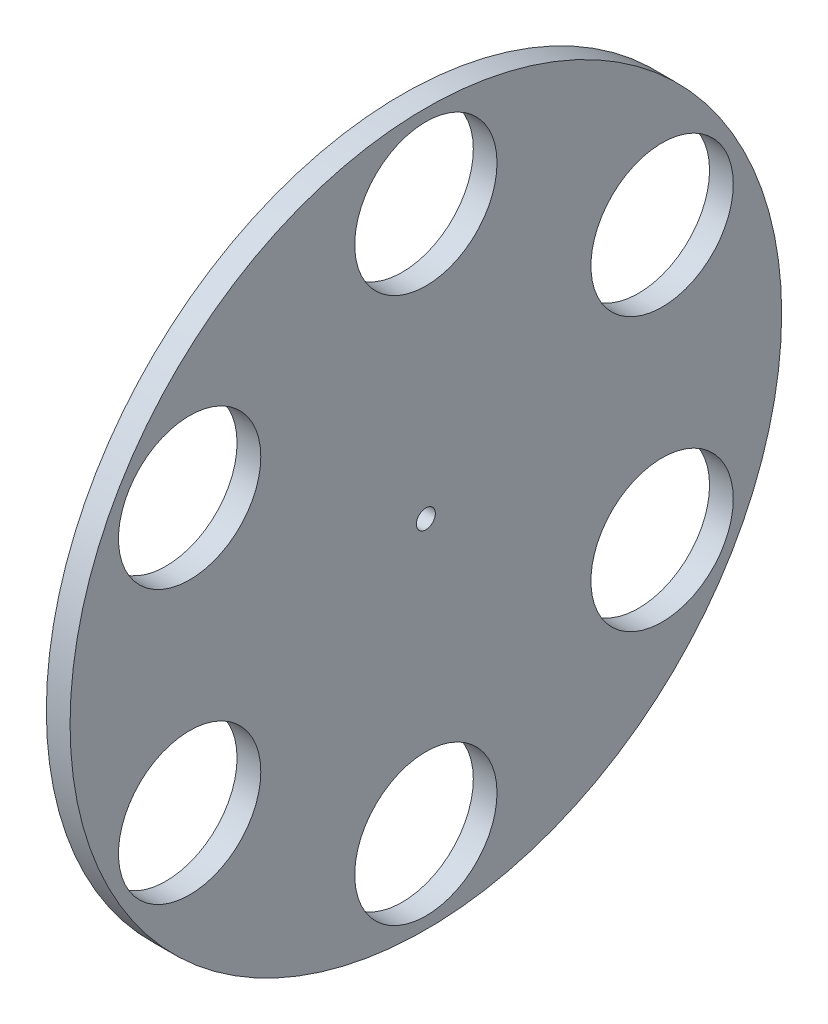
from build123d import *

# Parameters (mm, degrees)
SKETCH1_R           = 150
SKETCH1_R_2         = 4
SKETCH1_R_3         = 30
BOSS_EXTRUDE1_DEPTH = 10


with BuildPart() as part:
    # Sketch1 → Boss-Extrude1 (new body)
    with BuildSketch(Plane(origin=(0, 0, 0), x_dir=(0, 0, -1), z_dir=(1, 0, 0))):
        Circle(SKETCH1_R)
        Circle(SKETCH1_R_2, mode=Mode.SUBTRACT)
        with Locations((0, 115)):
            Circle(SKETCH1_R_3, mode=Mode.SUBTRACT)
        with Locations((99.592921435, 57.5)):
            Circle(SKETCH1_R_3, mode=Mode.SUBTRACT)
        with Locations((99.592921435, -57.5)):
            Circle(SKETCH1_R_3, mode=Mode.SUBTRACT)
        with Locations((0, -115)):
            Circle(SKETCH1_R_3, mode=Mode.SUBTRACT)
        with Locations((-99.592921435, -57.5)):
            Circle(SKETCH1_R_3, mode=Mode.SUBTRACT)
        with Locations((-99.592921435, 57.5)):
            Circle(SKETCH1_R_3, mode=Mode.SUBTRACT)
    extrude(amount=BOSS_EXTRUDE1_DEPTH)


solid = part.part
